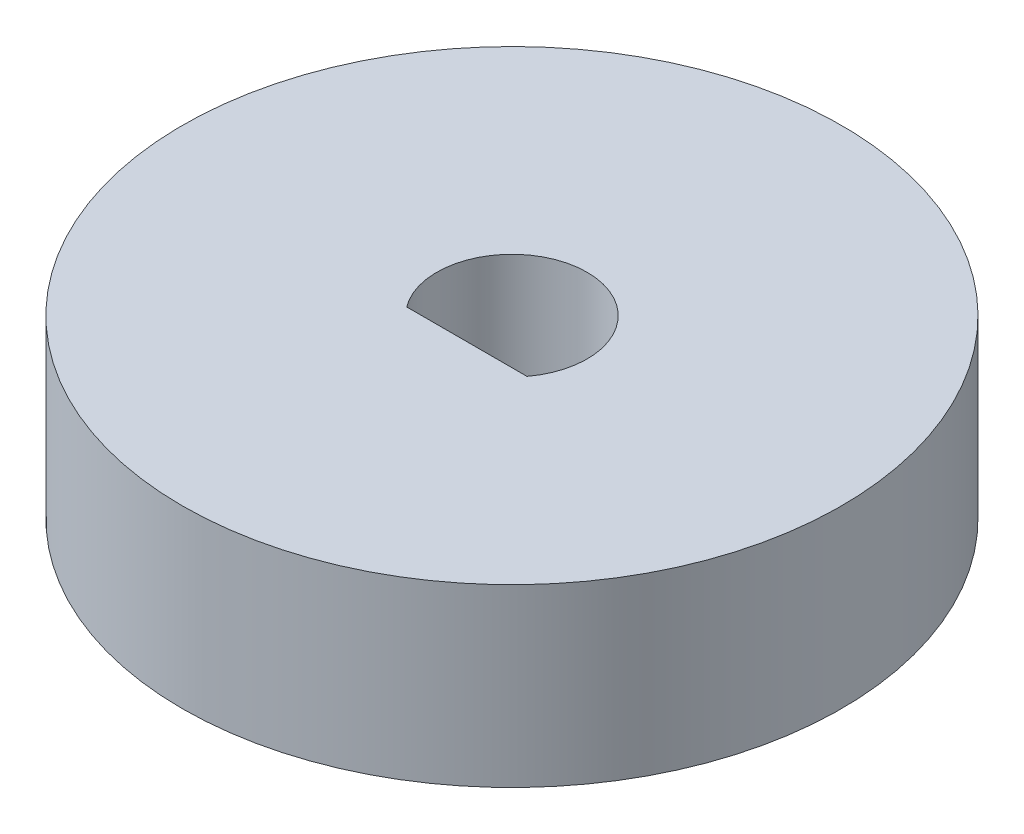
from build123d import *

# Parameters (mm, degrees)
SKETCH1_R           = 10.9601
BOSS_EXTRUDE1_DEPTH = 5.842
CUT_EXTRUDE1_DEPTH  = 17.564315501


with BuildPart() as part:
    # Sketch1 → Boss-Extrude1 (new body)
    with BuildSketch(Plane(origin=(0, 0, 0), x_dir=(1, 0, 0), z_dir=(0, 1, 0))):
        with Locations(Location((0, 0, 0), (0, 0, 270))):
            Circle(SKETCH1_R)
    extrude(amount=BOSS_EXTRUDE1_DEPTH)

    # Sketch3 → Cut-Extrude1 (cut, through all)
    with BuildSketch(Plane(origin=(0, 5.842, 0), x_dir=(1, 0, 0), z_dir=(0, 1, 0))):
        with BuildLine():
            Line((-2, -1.5), (2, -1.5))
            ThreePointArc((2, -1.5), (0, 2.5), (-2, -1.5))
        make_face()
    extrude(amount=-CUT_EXTRUDE1_DEPTH, mode=Mode.SUBTRACT)


solid = part.part
